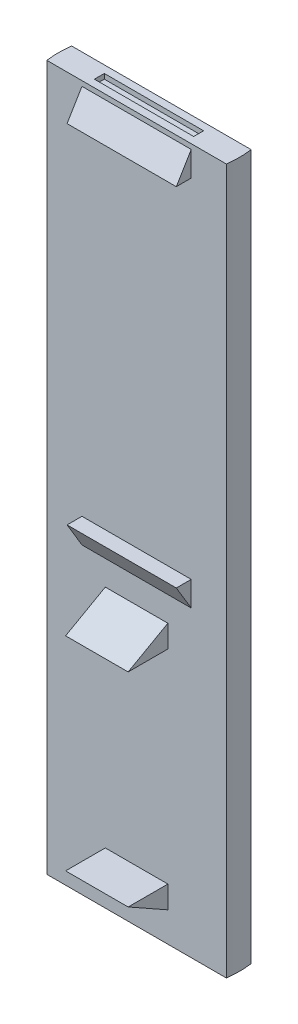
from build123d import *

# Parameters (mm, degrees)
SKETCH1_W           = 99.06
SKETCH1_H           = 360.68
BOSS_EXTRUDE1_DEPTH = 12.7
SKETCH3_W           = 32.004
SKETCH3_H           = 11.43
BOSS_EXTRUDE3_DEPTH = 20.32
SKETCH2_W           = 55.88
SKETCH2_H           = 12.7
BOSS_EXTRUDE4_DEPTH = 7.62
CUT_EXTRUDE2_DEPTH  = 38.1
SKETCH6_W           = 50.8
SKETCH6_H           = 5.08
CUT_EXTRUDE3_DEPTH  = 2.54
SKETCH7_R           = 50.8
SKETCH7_R_2         = 46.355
CUT_EXTRUDE4_DEPTH  = 366.559302576


with BuildPart() as part:
    # Sketch1 → Boss-Extrude1 (new body)
    with BuildSketch(Plane.XY):
        Rectangle(SKETCH1_W, SKETCH1_H)
    extrude(amount=BOSS_EXTRUDE1_DEPTH)

    # Sketch3 → Boss-Extrude3 (add)
    with BuildSketch(Plane(origin=(0, 0, 0), x_dir=(-1, 0, 0), z_dir=(0, 0, -1))):
        with Locations((0, -43.815)):
            Rectangle(SKETCH3_W, SKETCH3_H)
        with Locations((0, -159.385)):
            Rectangle(SKETCH3_W, SKETCH3_H)
    boss_extrude3 = extrude(amount=BOSS_EXTRUDE3_DEPTH)

    # Sketch2 → Boss-Extrude4 (add, symmetric)
    with BuildSketch(Plane.XY.offset(12.7)):
        with Locations((0, 171.45)):
            Rectangle(SKETCH2_W, SKETCH2_H)
        with Locations((0, -19.05)):
            Rectangle(SKETCH2_W, SKETCH2_H)
    extrude(amount=BOSS_EXTRUDE4_DEPTH, both=True)

    # Mirror1: Boss-Extrude3 across plane
    add(boss_extrude3.mirror(Plane.XY.offset(6.35)))

    # Sketch5 → Cut-Extrude2 (cut, symmetric)
    with BuildSketch(Plane(origin=(0, 0, 0), x_dir=(0, 0, -1), z_dir=(1, 0, 0))):
        Polygon((20.32, -153.67), (0, -165.1), (20.32, -165.1), align=None)
        Polygon((-33.02, -153.67), (-12.7, -165.1), (-33.02, -165.1), align=None)
        Polygon((-33.02, -49.53), (-33.02, -38.1), (-12.7, -38.1), align=None)
        Polygon((20.32, -49.53), (0, -38.1), (20.32, -38.1), align=None)
        Polygon((-12.7, 177.8), (-20.32, 165.1), (-20.32, 177.8), align=None)
        Polygon((-20.32, -12.7), (-12.7, -25.4), (-20.32, -25.4), align=None)
    extrude(amount=CUT_EXTRUDE2_DEPTH, both=True, mode=Mode.SUBTRACT)

    # Sketch6 → Cut-Extrude3 (cut)
    with BuildSketch(Plane(origin=(0, 180.34, 0), x_dir=(1, 0, 0), z_dir=(0, 1, 0))):
        with Locations((0, -6.35)):
            Rectangle(SKETCH6_W, SKETCH6_H)
    cut_extrude3 = extrude(amount=-CUT_EXTRUDE3_DEPTH, mode=Mode.SUBTRACT)

    # Mirror2: Cut-Extrude3 across plane
    add(cut_extrude3.mirror(Plane.ZX), mode=Mode.SUBTRACT)

    # Sketch7 → Cut-Extrude4 (cut, through all)
    with BuildSketch(Plane(origin=(0, 180.34, 0), x_dir=(1, 0, 0), z_dir=(0, 1, 0))):
        with Locations((0, -6.35)):
            Circle(SKETCH7_R)
        with Locations((0, -6.35)):
            Circle(SKETCH7_R_2, mode=Mode.SUBTRACT)
    extrude(amount=-CUT_EXTRUDE4_DEPTH, mode=Mode.SUBTRACT)


solid = part.part
